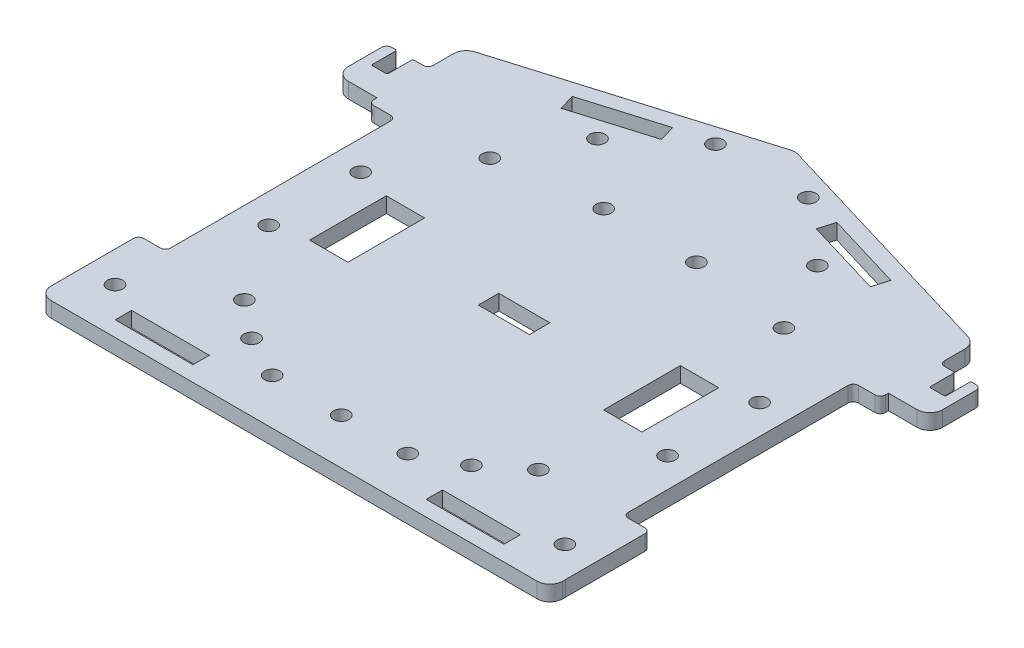
from build123d import *

# Parameters (mm, degrees)
CROQUIS3_R              = 1.5
CROQUIS3_W              = 10
CROQUIS3_H              = 4
CROQUIS3_W_2            = 7.5
CROQUIS3_H_2            = 15
SALIENTE_EXTRUIR1_DEPTH = 3
CROQUIS4_R              = 1.5
CROQUIS4_W              = 14
CROQUIS4_H              = 45
CROQUIS4_W_2            = 15.2
CROQUIS4_H_2            = 3.2
CORTAR_EXTRUIR1_DEPTH   = 3
SALIENTE_EXTRUIR2_DEPTH = 3
REDONDEO1_R             = 1
REDONDEO2_R             = 0.25
CROQUIS9_R              = 1.5
CORTAR_EXTRUIR3_DEPTH   = 5


with BuildPart() as part:
    # Croquis3 → Saliente-Extruir1 (new body)
    with BuildSketch(Plane(origin=(0, 0, 0), x_dir=(1, 0, 0), z_dir=(0, 1, 0))):
        with BuildLine():
            Line((-50, -40), (50, -40))
            Line((50, -40), (50, 23.189923373))
            Line((50, 23.189923373), (55.6, 23.189923373))
            ThreePointArc((55.6, 23.189923373), (57.367766953, 23.92215642), (58.1, 25.689923373))
            Line((58.1, 25.689923373), (58.1, 33.189923373))
            Line((58.1, 33.189923373), (56.1, 33.189923373))
            Line((56.1, 33.189923373), (56.1, 28.189923373))
            Line((56.1, 28.189923373), (53, 28.189923373))
            Line((53, 28.189923373), (53, 33.189923373))
            Line((53, 33.189923373), (50, 33.189923373))
            Line((50, 33.189923373), (50, 38.139923373))
            ThreePointArc((50, 38.139923373), (49.505732321, 39.632249697), (48.218369714, 40.534489086))
            Line((48.218369714, 40.534489086), (0.718369714, 54.784489086))
            ThreePointArc((0.718369714, 54.784489086), (0, 54.889923373), (-0.718369714, 54.784489086))
            Line((-0.718369714, 54.784489086), (-48.218369714, 40.534489086))
            ThreePointArc((-48.218369714, 40.534489086), (-49.505732321, 39.632249697), (-50, 38.139923373))
            Line((-50, 38.139923373), (-50, 33.189923373))
            Line((-50, 33.189923373), (-53, 33.189923373))
            Line((-53, 33.189923373), (-53, 28.189923373))
            Line((-53, 28.189923373), (-56.1, 28.189923373))
            Line((-56.1, 28.189923373), (-56.1, 33.189923373))
            Line((-56.1, 33.189923373), (-58.1, 33.189923373))
            Line((-58.1, 33.189923373), (-58.1, 25.689923373))
            ThreePointArc((-58.1, 25.689923373), (-57.367766953, 23.92215642), (-55.6, 23.189923373))
            Line((-55.6, 23.189923373), (-50, 23.189923373))
            Line((-50, 23.189923373), (-50, -40))
        make_face()
        with Locations(Location((-21.533414662, 37.830612774, 0), (0, 0, 270))):
            Circle(CROQUIS3_R, mode=Mode.SUBTRACT)
        with Locations(Location((21.466585338, 37.830612774, 0), (0, 0, 270))):
            Circle(CROQUIS3_R, mode=Mode.SUBTRACT)
        with Locations(Location((21.466585338, -29.811737192, 0), (0, 0, 270))):
            Circle(CROQUIS3_R, mode=Mode.SUBTRACT)
        with Locations(Location((-21.533414662, -29.811737192, 0), (0, 0, 270))):
            Circle(CROQUIS3_R, mode=Mode.SUBTRACT)
        Rectangle(CROQUIS3_W, CROQUIS3_H, mode=Mode.SUBTRACT)
        with Locations((28.75, 0)):
            Rectangle(CROQUIS3_W_2, CROQUIS3_H_2, mode=Mode.SUBTRACT)
        with Locations((-28.75, 0)):
            Rectangle(CROQUIS3_W_2, CROQUIS3_H_2, mode=Mode.SUBTRACT)
        Polygon((-31.156326057, 42.52101023), (-16.056326057, 47.05101023), (-15.126326057, 43.95101023), (-30.226326057, 39.42101023), align=None, mode=Mode.SUBTRACT)
        Polygon((15.126326057, 43.95101023), (30.226326057, 39.42101023), (31.156326057, 42.52101023), (16.056326057, 47.05101023), align=None, mode=Mode.SUBTRACT)
    extrude(amount=SALIENTE_EXTRUIR1_DEPTH)

    # Croquis4 → Cortar-Extruir1 (cut, symmetric)
    with BuildSketch(Plane(origin=(0, 3, 0), x_dir=(1, 0, 0), z_dir=(0, 1, 0))):
        with Locations(Location((28.75, 24, 0), (0, 0, 270))):
            Circle(CROQUIS4_R)
        with Locations(Location((-28.75, 24, 0), (0, 0, 270))):
            Circle(CROQUIS4_R)
        with Locations(Location((28.75, -24, 0), (0, 0, 270))):
            Circle(CROQUIS4_R)
        with Locations(Location((-28.75, -24, 0), (0, 0, 270))):
            Circle(CROQUIS4_R)
        with Locations(Location((0.25, -34.055868596, 0), (0, 0, 270))):
            Circle(CROQUIS4_R)
        with Locations(Location((-13.25, -34.055868596, 0), (0, 0, 270))):
            Circle(CROQUIS4_R)
        with Locations(Location((13.25, -34.055868596, 0), (0, 0, 270))):
            Circle(CROQUIS4_R)
        with Locations(Location((-39, 9, 0), (0, 0, 270))):
            Circle(CROQUIS4_R)
        with Locations(Location((39, 9, 0), (0, 0, 270))):
            Circle(CROQUIS4_R)
        with Locations(Location((39, -9, 0), (0, 0, 270))):
            Circle(CROQUIS4_R)
        with Locations(Location((-39, -9, 0), (0, 0, 270))):
            Circle(CROQUIS4_R)
        with Locations(Location((-43.980956203, -34.055868596, 0), (0, 0, 270))):
            Circle(CROQUIS4_R)
        with Locations(Location((43.980956203, -34.055868596, 0), (0, 0, 270))):
            Circle(CROQUIS4_R)
        with Locations((51.75, -0.930038314)):
            Rectangle(CROQUIS4_W, CROQUIS4_H)
        with Locations((-51.75, -0.930038314)):
            Rectangle(CROQUIS4_W, CROQUIS4_H)
        with Locations((-30.4, -38.4)):
            Rectangle(CROQUIS4_W_2, CROQUIS4_H_2)
        with Locations((30.4, -38.4)):
            Rectangle(CROQUIS4_W_2, CROQUIS4_H_2)
    extrude(amount=CORTAR_EXTRUIR1_DEPTH, both=True, mode=Mode.SUBTRACT)

    # Croquis5 → Saliente-Extruir2 (add)
    with BuildSketch(Plane(origin=(0, 0, 0), x_dir=(1, 0, 0), z_dir=(0, 1, 0))):
        with BuildLine():
            Line((-50, -40), (49.999265674, -40))
            Line((49.999265674, -40), (49.999265674, -40.5))
            ThreePointArc((49.999265674, -40.5), (49.267032626, -42.267766953), (47.499265674, -43))
            Line((47.499265674, -43), (-47.5, -43))
            ThreePointArc((-47.5, -43), (-49.267766953, -42.267766953), (-50, -40.5))
            Line((-50, -40.5), (-50, -40))
        make_face()
    extrude(amount=SALIENTE_EXTRUIR2_DEPTH)

    # Redondeo1
    redondeo1_edges = [part.edges().sort_by_distance(p)[0] for p in [
        (-50, 1.5, -21.569961686),
        (-50, 1.5, 23.430038314),
        (50, 1.5, -21.569961686),
        (50, 1.5, 23.430038314),
        (-44.75, 1.5, -21.569961686),
        (-44.75, 1.5, 23.430038314),
        (44.75, 1.5, 23.430038314),
        (44.75, 1.5, -21.569961686),
        (-58.1, 1.5, -33.189923373),
        (-50, 1.5, -33.189923373),
        (50, 1.5, -33.189923373),
        (58.1, 1.5, -33.189923373),
    ]]
    fillet(redondeo1_edges, radius=REDONDEO1_R)

    # Redondeo2
    redondeo2_edges = [part.edges().sort_by_distance(p)[0] for p in [
        (-56.1, 1.5, -33.189923373),
        (-56.1, 1.5, -28.189923373),
        (-53, 1.5, -28.189923373),
        (-53, 1.5, -33.189923373),
        (53, 1.5, -33.189923373),
        (53, 1.5, -28.189923373),
        (56.1, 1.5, -28.189923373),
        (56.1, 1.5, -33.189923373),
    ]]
    fillet(redondeo2_edges, radius=REDONDEO2_R)

    # Croquis9 → Cortar-Extruir3 (cut, symmetric)
    with BuildSketch(Plane(origin=(0, 3, 0), x_dir=(1, 0, 0), z_dir=(0, 1, 0))):
        with Locations(Location((-9.075164729, 48.441511714, 0), (0, 0, 270))):
            Circle(CROQUIS9_R)
        with Locations(Location((-9.075164729, 26.572395433, 0), (0, 0, 270))):
            Circle(CROQUIS9_R)
        with Locations(Location((9.075164729, 26.572395433, 0), (0, 0, 270))):
            Circle(CROQUIS9_R)
        with Locations(Location((9.075164729, 48.441511714, 0), (0, 0, 270))):
            Circle(CROQUIS9_R)
    extrude(amount=CORTAR_EXTRUIR3_DEPTH, both=True, mode=Mode.SUBTRACT)


solid = part.part
